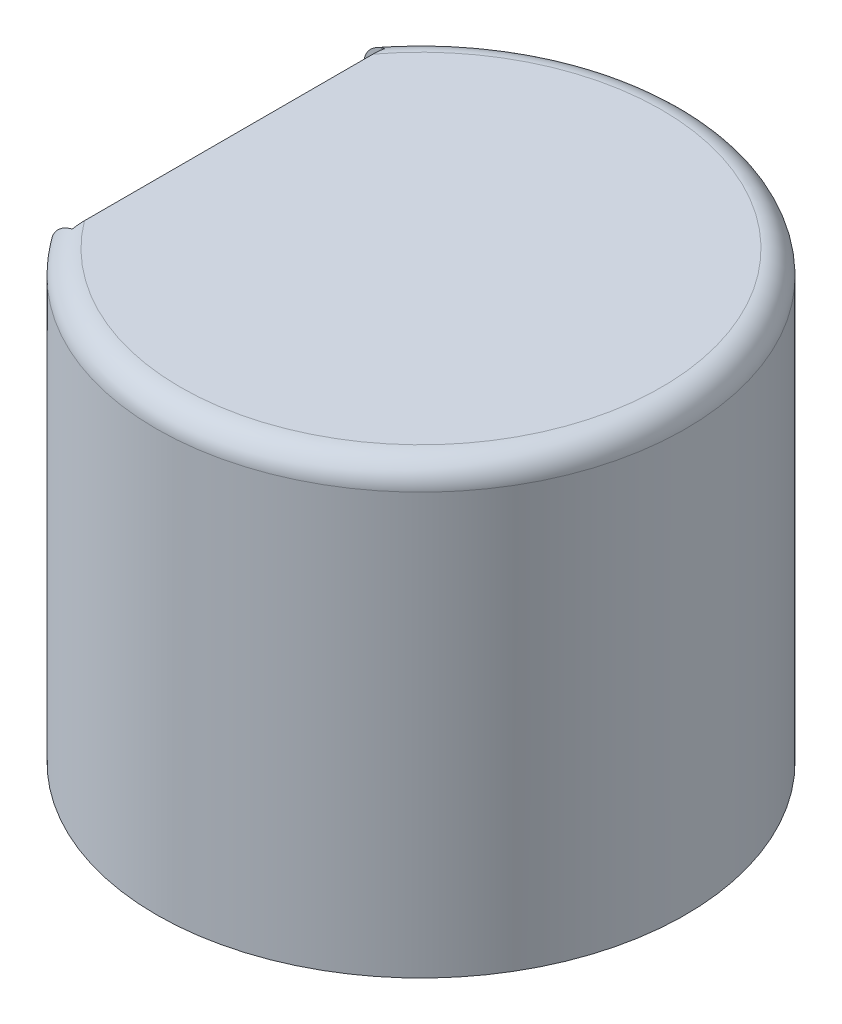
from build123d import *

# Parameters (mm, degrees)
SKETCH1_R           = 11
BOSS_EXTRUDE1_DEPTH = 18.5
CUT_EXTRUDE1_DEPTH  = 4
FILLET1_R           = 1


with BuildPart() as part:
    # Sketch1 → Boss-Extrude1 (new body)
    with BuildSketch(Plane(origin=(0, 0, 0), x_dir=(1, 0, 0), z_dir=(0, 1, 0))):
        with Locations(Location((0, 0, 0), (0, 0, 270))):
            Circle(SKETCH1_R)
    extrude(amount=-BOSS_EXTRUDE1_DEPTH)

    # Sketch4 → Cut-Extrude1 (cut)
    with BuildSketch(Plane(origin=(0, 0, 0), x_dir=(1, 0, 0), z_dir=(0, 1, 0))):
        with BuildLine():
            Line((-8, -6.5), (-8, 0))
            Line((-8, 0), (-8, 6.5))
            Line((-8, 6.5), (-8.874119675, 6.5))
            ThreePointArc((-8.874119675, 6.5), (-11, 0), (-8.874119675, -6.5))
            Line((-8.874119675, -6.5), (-8, -6.5))
        make_face()
    extrude(amount=-CUT_EXTRUDE1_DEPTH, mode=Mode.SUBTRACT)

    # Fillet1
    fillet1_edges = [part.edges().sort_by_distance(p)[0] for p in [
        (9.810708435, 0, -4.974937186),
    ]]
    fillet(fillet1_edges, radius=FILLET1_R)


solid = part.part
